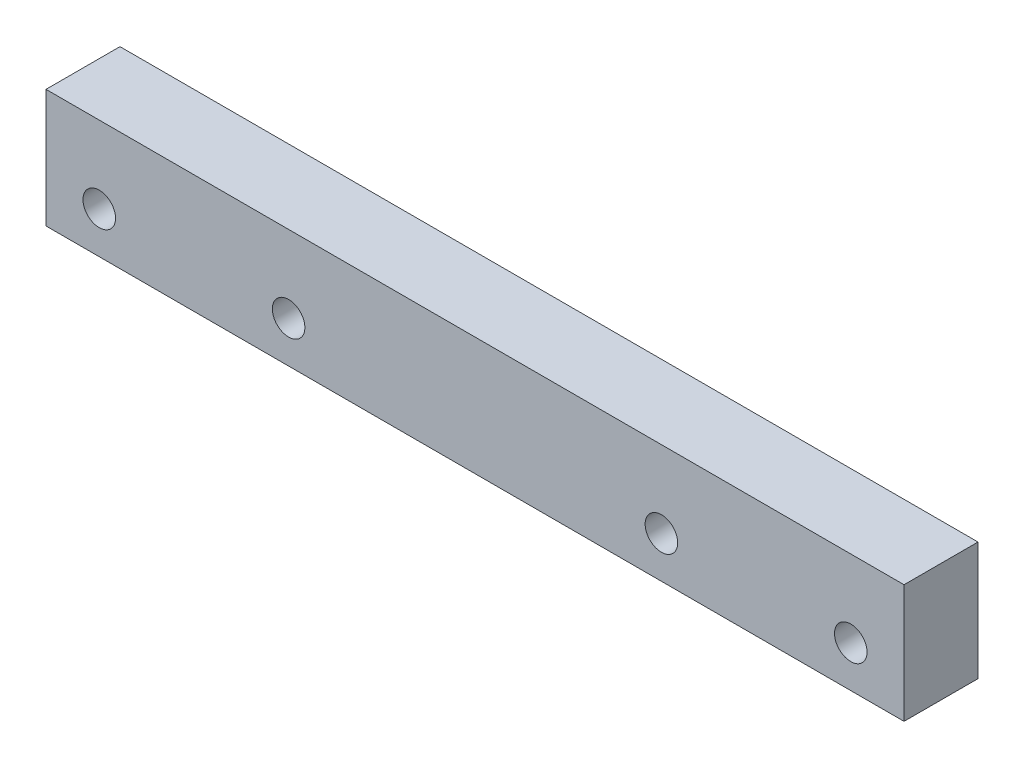
from build123d import *

# Parameters (mm, degrees)
SKETCH_1_W          = 145
SKETCH_1_H          = 20
EXTRUDE_1_DEPTH     = 12.5
SKETCH_2_R          = 2.75
CUT_EXTRUDE_1_DEPTH = 12.5


with BuildPart() as part:
    # 草图1 → 凸台-拉伸1 (new body)
    with BuildSketch(Plane.XY):
        Rectangle(SKETCH_1_W, SKETCH_1_H)
    extrude(amount=EXTRUDE_1_DEPTH)

    # 草图2 → 切除-拉伸1 (cut)
    with BuildSketch(Plane(origin=(0, 0, 0), x_dir=(-1, 0, 0), z_dir=(0, 0, -1))):
        with Locations((-63.5, -3)):
            Circle(SKETCH_2_R)
        with Locations((-31.5, -3)):
            Circle(SKETCH_2_R)
        with Locations((31.5, -3)):
            Circle(SKETCH_2_R)
        with Locations((63.5, -3)):
            Circle(SKETCH_2_R)
    extrude(amount=-CUT_EXTRUDE_1_DEPTH, mode=Mode.SUBTRACT)


solid = part.part
